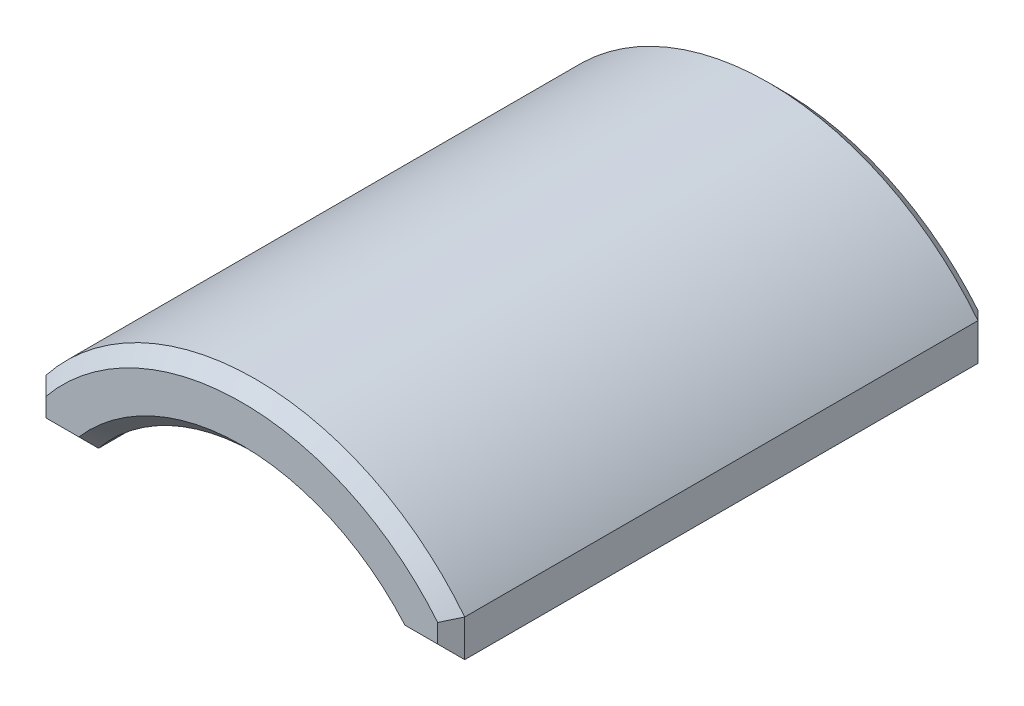
from build123d import *

# Parameters (mm, degrees)
BASE_EXTRUSION_DEPTH = 40
CHANFREIN1_SIZE      = 1


with BuildPart() as part:
    # Esquisse1 → Base-Extrusion (new body)
    with BuildSketch(Plane.XY):
        with BuildLine():
            Line((15.5, 12.239791665), (15.5, 9.5))
            Line((15.5, 9.5), (11.608186766, 9.5))
            ThreePointArc((11.608186766, 9.5), (0, 15), (-11.608186766, 9.5))
            Line((-11.608186766, 9.5), (-15.5, 9.5))
            Line((-15.5, 9.5), (-15.5, 12.239791665))
            ThreePointArc((-15.5, 12.239791665), (0, 19.75), (15.5, 12.239791665))
        make_face()
    extrude(amount=BASE_EXTRUSION_DEPTH)

    # Chanfrein1
    chanfrein1_edges = [part.edges().sort_by_distance(p)[0] for p in [
        (15.5, 10.869895832, 0),
        (15.5, 10.869895832, 40),
        (13.554093383, 9.5, 0),
        (13.554093383, 9.5, 40),
        (0, 15, 0),
        (0, 15, 40),
        (-13.554093383, 9.5, 0),
        (-13.554093383, 9.5, 40),
        (-15.5, 10.869895832, 0),
        (-15.5, 10.869895832, 40),
        (0, 19.75, 0),
        (0, 19.75, 40),
    ]]
    chamfer(chanfrein1_edges, length=CHANFREIN1_SIZE)


solid = part.part
